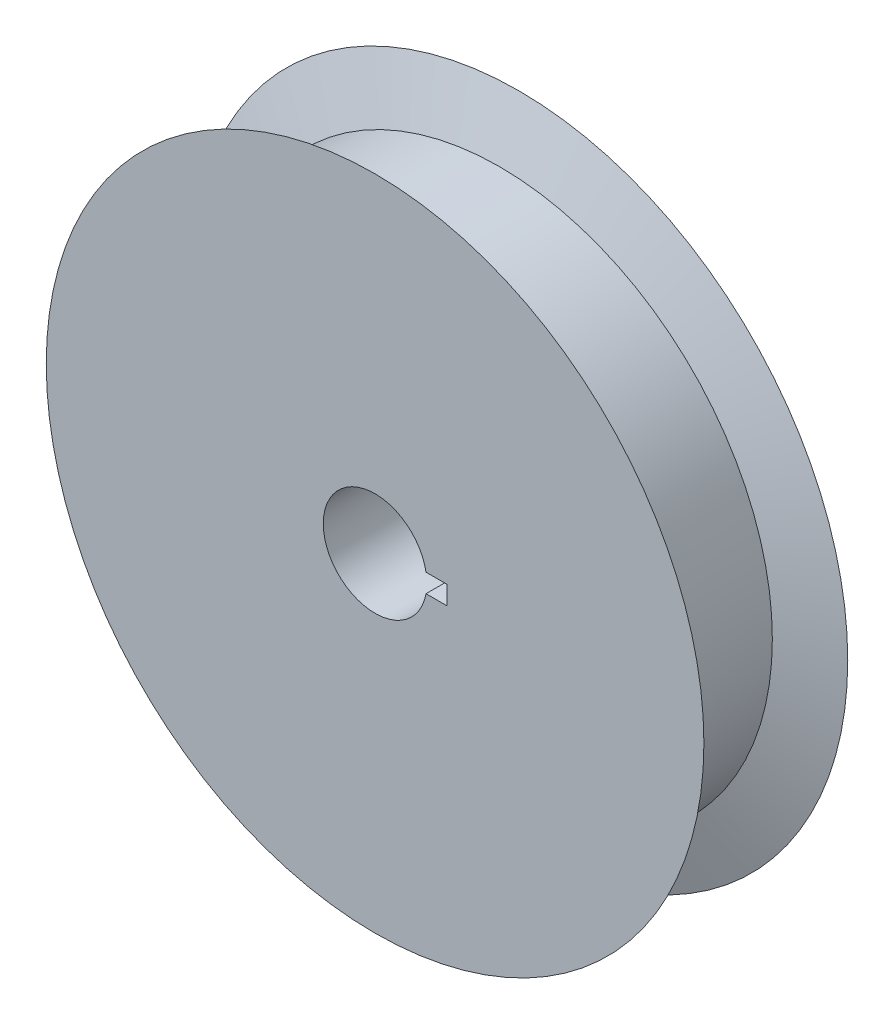
from build123d import *

# Parameters (mm, degrees)
SKETCH1_R               = 38.1
BOSS_EXTRUDE1_DEPTH     = 16.66748
SKETCH2_R               = 19.84375
BOSS_EXTRUDE2_DEPTH     = 11.1125
CUT_EXTRUDE1_DEPTH      = 61.621343509
CUT_EXTRUDE2_DEPTH      = 11.1125
CUT_EXTRUDE2_DEPTH_BACK = 11.1125
SKETCH5_R               = 3.2639


with BuildPart() as part:
    # Sketch1 → Boss-Extrude1 (new body)
    with BuildSketch(Plane.XY):
        Circle(SKETCH1_R)
    extrude(amount=BOSS_EXTRUDE1_DEPTH)

    # Sketch2 → Boss-Extrude2 (add)
    with BuildSketch(Plane(origin=(0, 0, 0), x_dir=(-1, 0, 0), z_dir=(0, 0, -1))):
        with Locations(Location((0, 0, 0), (0, 0, 180))):
            Circle(SKETCH2_R)
    extrude(amount=BOSS_EXTRUDE2_DEPTH)

    # Sketch3 → Cut-Extrude1 (cut, through all)
    with BuildSketch(Plane(origin=(0, 0, -11.1125), x_dir=(-1, 0, 0), z_dir=(0, 0, -1))):
        with BuildLine():
            Line((-5.902263385, -1.078557803), (-8.315263385, -1.078557803))
            Line((-8.315263385, -1.078557803), (-8.315263385, 1.078557803))
            Line((-8.315263385, 1.078557803), (-5.902263385, 1.078557803))
            ThreePointArc((-5.902263385, 1.078557803), (6, 0), (-5.902263385, -1.078557803))
        make_face()
    extrude(amount=-CUT_EXTRUDE1_DEPTH, mode=Mode.SUBTRACT)

    # Sketch5 → Cut-Extrude2 (cut, two sides: drawn at the far end of the back side and taken through both)
    with BuildSketch(Plane(origin=(0, -9.525, 0), x_dir=(1, 0, 0), z_dir=(0, 1, 0)).offset(-CUT_EXTRUDE2_DEPTH_BACK)):
        with Locations(Location((0.599890424, 5.55752, 0), (0, 0, 90))):
            Circle(SKETCH5_R)
    extrude(amount=CUT_EXTRUDE2_DEPTH + CUT_EXTRUDE2_DEPTH_BACK, mode=Mode.SUBTRACT)

    # Sketch7 → Cut-Revolve1 (revolve, cut)
    with BuildSketch(Plane(origin=(0, 0, 0), x_dir=(0, 0, -1), z_dir=(1, 0, 0)), mode=Mode.PRIVATE) as cut_revolve1_sk:
        Polygon((-16.66748, 38.1), (0, 38.1), (-2.23774, 31.601131151), (-14.42974, 31.601131151), align=None)
    revolve(cut_revolve1_sk.sketch.rotate(Axis((0, 0, 16.66748), (0, 0, -1)), 90), axis=Axis((0, 0, 16.66748), (0, 0, -1)), mode=Mode.SUBTRACT)


solid = part.part
